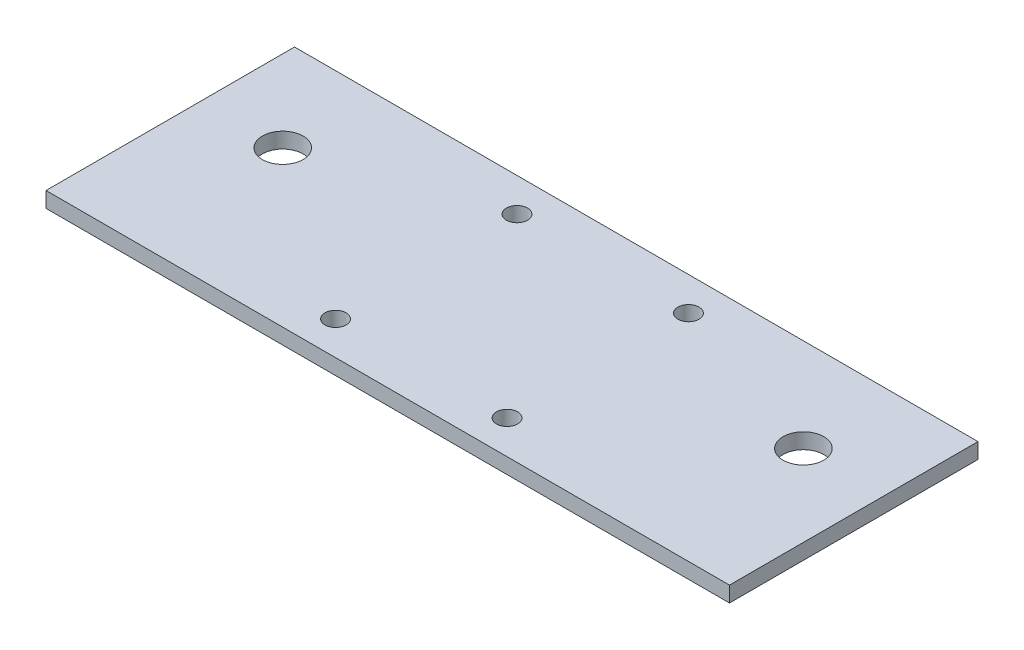
from build123d import *

# Parameters (mm, degrees)
SKETCH1_W           = 139.7
SKETCH1_H           = 50.8
SKETCH1_R           = 2.159
SKETCH1_R_2         = 4.1656
BOSS_EXTRUDE1_DEPTH = 3.175


with BuildPart() as part:
    # Sketch1 → Boss-Extrude1 (new body)
    with BuildSketch(Plane(origin=(0, 0, 0), x_dir=(1, 0, 0), z_dir=(0, 1, 0))):
        with Locations((17.526, -18.542)):
            Rectangle(SKETCH1_W, SKETCH1_H)
        with Locations(Location((0, 0, 0), (0, 0, 270))):
            Circle(SKETCH1_R, mode=Mode.SUBTRACT)
        with Locations(Location((35.052, 0, 0), (0, 0, 270))):
            Circle(SKETCH1_R, mode=Mode.SUBTRACT)
        with Locations(Location((0, -37.084, 0), (0, 0, 270))):
            Circle(SKETCH1_R, mode=Mode.SUBTRACT)
        with Locations(Location((35.052, -37.084, 0), (0, 0, 270))):
            Circle(SKETCH1_R, mode=Mode.SUBTRACT)
        with Locations(Location((-35.687, -12.192, 0), (0, 0, 270))):
            Circle(SKETCH1_R_2, mode=Mode.SUBTRACT)
        with Locations(Location((70.739, -12.192, 0), (0, 0, 270))):
            Circle(SKETCH1_R_2, mode=Mode.SUBTRACT)
    extrude(amount=BOSS_EXTRUDE1_DEPTH)


solid = part.part
